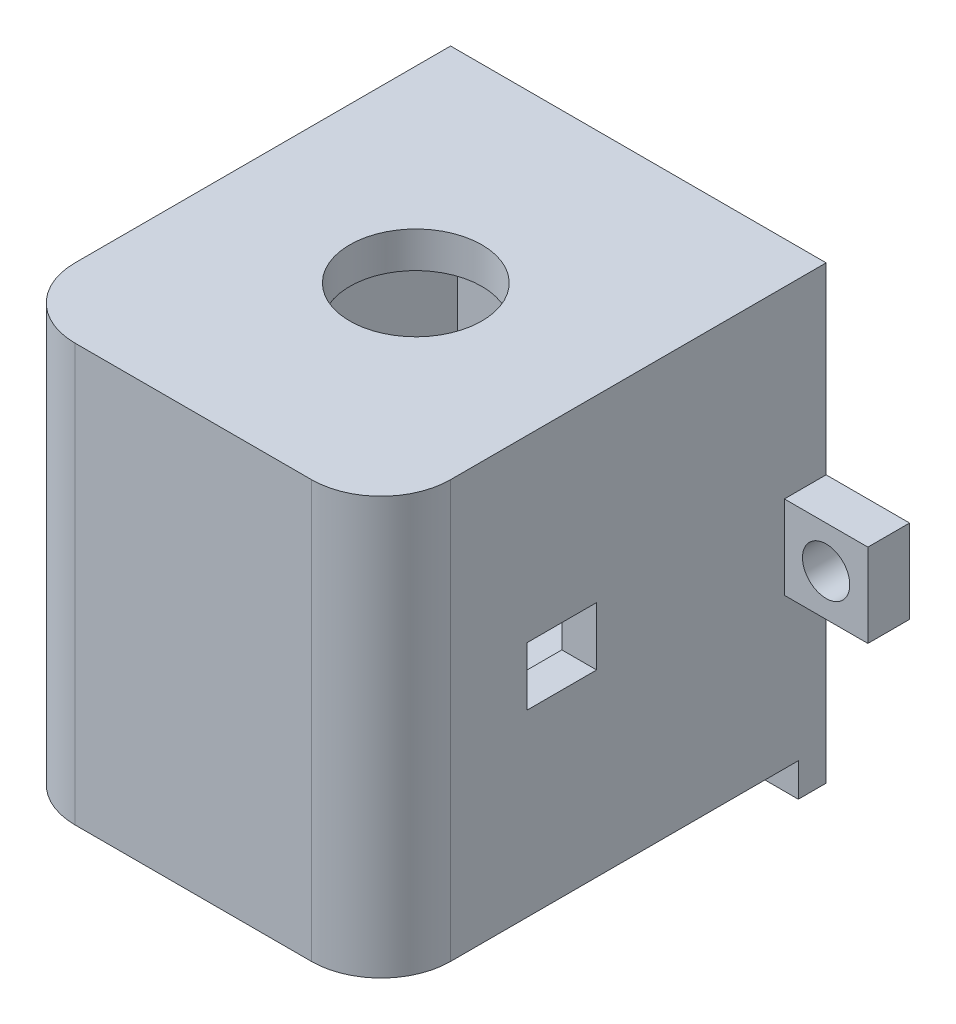
from build123d import *

# Parameters (mm, degrees)
SKETCH1_W           = 27
SKETCH1_H           = 30
SKETCH1_W_2         = 22
SKETCH1_H_2         = 25
BOSS_EXTRUDE1_DEPTH = 28
SKETCH2_R           = 2.5
CUT_EXTRUDE1_DEPTH  = 14
SKETCH3_W           = 5
SKETCH3_H           = 4.2
CUT_EXTRUDE2_DEPTH  = 14
SKETCH4_R           = 4.75
CUT_EXTRUDE3_DEPTH  = 58
SKETCH5_W           = 27
SKETCH5_H           = 30
BOSS_EXTRUDE2_DEPTH = 2
SKETCH6_W           = 27
SKETCH6_H           = 32.4
BOSS_EXTRUDE3_DEPTH = 2
SKETCH7_R           = 1.7
BOSS_EXTRUDE4_DEPTH = 3
FILLET11_R          = 5


with BuildPart() as part:
    # Sketch1 → Boss-Extrude1 (new body)
    with BuildSketch(Plane.XY):
        with Locations((0, 1.2)):
            Rectangle(SKETCH1_W, SKETCH1_H)
        with Locations((0, 1.108503026)):
            Rectangle(SKETCH1_W_2, SKETCH1_H_2, mode=Mode.SUBTRACT)
    extrude(amount=BOSS_EXTRUDE1_DEPTH)

    # Sketch2 → Cut-Extrude1 (cut, symmetric)
    with BuildSketch(Plane.ZY.offset(13.5)):
        with Locations(Location((17, 1.2, 0), (0, 0, 180))):
            Circle(SKETCH2_R)
    extrude(amount=CUT_EXTRUDE1_DEPTH, both=True, mode=Mode.SUBTRACT)

    # Sketch3 → Cut-Extrude2 (cut, symmetric)
    with BuildSketch(Plane(origin=(13.5, 0, 0), x_dir=(0, 0, -1), z_dir=(1, 0, 0))):
        with Locations((-17, 1.2)):
            Rectangle(SKETCH3_W, SKETCH3_H)
    extrude(amount=CUT_EXTRUDE2_DEPTH, both=True, mode=Mode.SUBTRACT)

    # Sketch4 → Cut-Extrude3 (cut)
    with BuildSketch(Plane.XZ.offset(13.8)):
        with Locations(Location((0, 14, 0), (0, 0, 270))):
            Circle(SKETCH4_R)
    extrude(amount=-CUT_EXTRUDE3_DEPTH, mode=Mode.SUBTRACT)

    # Sketch5 → Boss-Extrude2 (add)
    with BuildSketch(Plane.XY.offset(28)):
        with Locations((0, 1.2)):
            Rectangle(SKETCH5_W, SKETCH5_H)
    extrude(amount=BOSS_EXTRUDE2_DEPTH)

    # Sketch6 → Boss-Extrude3 (add)
    with BuildSketch(Plane(origin=(0, 0, 0), x_dir=(-1, 0, 0), z_dir=(0, 0, -1))):
        Rectangle(SKETCH6_W, SKETCH6_H)
    extrude(amount=BOSS_EXTRUDE3_DEPTH)

    # Sketch7 → Boss-Extrude4 (add)
    with BuildSketch(Plane(origin=(0, 0, -2), x_dir=(-1, 0, 0), z_dir=(0, 0, -1))):
        Polygon((-13.5, 0), (-13.5, 3), (-19.5, 3), (-19.5, -3), (-13.5, -3), align=None)
        with Locations((-16.5, 0)):
            Circle(SKETCH7_R, mode=Mode.SUBTRACT)
    boss_extrude4 = extrude(amount=-BOSS_EXTRUDE4_DEPTH)

    # Mirror2: Boss-Extrude4 across plane
    add(boss_extrude4.mirror(Plane(origin=(0, 0, 0), x_dir=(0, 0, 1), z_dir=(1, 0, 0))))

    # Fillet11
    fillet11_edges = [part.edges().sort_by_distance(p)[0] for p in [
        (-13.5, 1.2, 30),
        (13.5, 1.2, 30),
    ]]
    fillet(fillet11_edges, radius=FILLET11_R)

    # Mirror1: Boss-Extrude4 across plane
    add(boss_extrude4.mirror(Plane(origin=(0, 0, 0), x_dir=(0, 0, 1), z_dir=(1, 0, 0))))


solid = part.part
